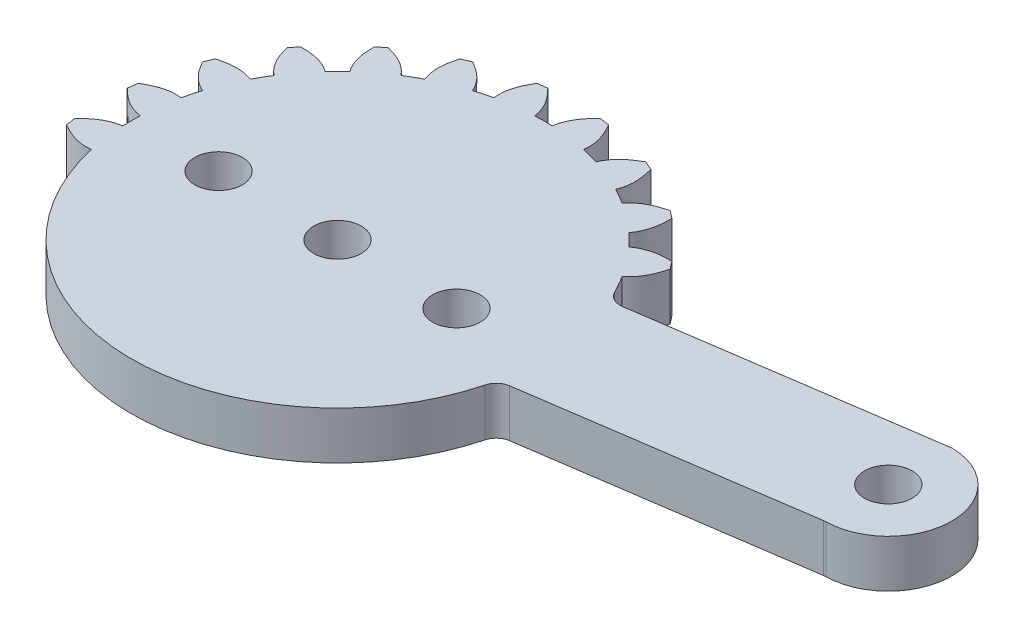
from build123d import *

# Parameters (mm, degrees)
SKETCH1_R           = 1.5
BOSS_EXTRUDE1_DEPTH = 3
L_EK1_SCALE         = 2


with BuildPart() as part:
    # Sketch1 → Boss-Extrude1 (new body)
    with BuildSketch(Plane(origin=(0, 0, 0), x_dir=(1, 0, 0), z_dir=(0, 1, 0))):
        with BuildLine():
            Line((12.632699085, 5.340493617), (30.652467528, 7.988606141))
            ThreePointArc((30.652467528, 7.988606141), (30.736256439, 7.997332941), (30.820482547, 7.998976483))
            ThreePointArc((30.820482547, 7.998976483), (34.729974115, 3.985609874), (30.791707503, 0.000476005))
            ThreePointArc((30.791707503, 0.000476005), (30.726552312, -0.002657016), (30.661739998, -0.010031215))
            Line((30.661739998, -0.010031215), (13.400696346, -2.546644602))
            ThreePointArc((13.400696346, -2.546644602), (12.878710947, -2.791300832), (12.578512819, -3.283445639))
            ThreePointArc((12.578512819, -3.283445639), (0.316986254, -12.996134799), (-12.403478945, -3.892776652))
            add(Edge.make_bspline(
                [(-12.403478945, -3.892776652), (-12.568432388, -3.367671042), (-12.688169827, -2.830255546)],
                knots=[0, 0, 0, 0.029411494, 0.029411494, 0.029411494], degree=2))
            add(Edge.make_bspline(
                [(-12.688169827, -2.830255546), (-13.526378309, -2.92825021), (-14.200348489, -2.631756771), (-14.828036033, -2.264806262)],
                knots=[0, 0, 0, 0, 0.585569533, 0.585569533, 0.585569533, 0.585569533], degree=3))
            add(Edge.make_bspline(
                [(-14.828036033, -2.264806262), (-14.874848849, -1.958311002), (-14.908957951, -1.650143267)],
                knots=[0, 0, 0, 1, 1, 1], degree=2))
            add(Edge.make_bspline(
                [(-12.988354961, -0.550123072), (-13.823365068, -0.672411814), (-14.397632122, -1.133238803), (-14.908957951, -1.650143267)],
                knots=[0, 0, 0, 0, 0.585569533, 0.585569533, 0.585569533, 0.585569533], degree=3))
            add(Edge.make_bspline(
                [(-12.988354961, -0.550123072), (-13.003945727, -0.183508375), (-13.00394681, 0.183466584), (-12.988354961, 0.550123072)],
                knots=[0.090903106, 0.090903106, 0.090903106, 0.090903106, 0.120321184, 0.120321184, 0.120321184, 0.120321184], degree=3))
            add(Edge.make_bspline(
                [(-12.988354961, 0.550123072), (-13.823365068, 0.672411814), (-14.397632122, 1.133238803), (-14.908957951, 1.650143267)],
                knots=[0, 0, 0, 0, 0.585569533, 0.585569533, 0.585569533, 0.585569533], degree=3))
            add(Edge.make_bspline(
                [(-14.908957951, 1.650143267), (-14.874848849, 1.958311002), (-14.828036033, 2.264806262)],
                knots=[0, 0, 0, 1, 1, 1], degree=2))
            add(Edge.make_bspline(
                [(-12.688169827, 2.830255546), (-13.526378309, 2.92825021), (-14.200348489, 2.631756771), (-14.828036033, 2.264806262)],
                knots=[0, 0, 0, 0, 0.585569533, 0.585569533, 0.585569533, 0.585569533], degree=3))
            add(Edge.make_bspline(
                [(-12.688169827, 2.830255546), (-12.60833596, 3.18844173), (-12.513361148, 3.542894104), (-12.40340517, 3.893011712)],
                knots=[0.181812796, 0.181812796, 0.181812796, 0.181812796, 0.211230873, 0.211230873, 0.211230873, 0.211230873], degree=3))
            add(Edge.make_bspline(
                [(-12.40340517, 3.893011712), (-13.178312342, 4.227250084), (-13.613740919, 4.821006025), (-13.973859024, 5.452638259)],
                knots=[0, 0, 0, 0, 0.585569533, 0.585569533, 0.585569533, 0.585569533], degree=3))
            add(Edge.make_bspline(
                [(-13.973859024, 5.452638259), (-13.861152482, 5.741477348), (-13.736607963, 6.025412987)],
                knots=[0, 0, 0, 1, 1, 1], degree=2))
            add(Edge.make_bspline(
                [(-11.523306886, 6.017756925), (-12.307591221, 6.329356822), (-13.035334574, 6.217402469), (-13.736607963, 6.025412987)],
                knots=[0, 0, 0, 0, 0.585569533, 0.585569533, 0.585569533, 0.585569533], degree=3))
            add(Edge.make_bspline(
                [(-11.523306886, 6.017756925), (-11.35348747, 6.343077502), (-11.170010092, 6.660869731), (-10.973183814, 6.970598036)],
                knots=[0.272722485, 0.272722485, 0.272722485, 0.272722485, 0.302140562, 0.302140562, 0.302140562, 0.302140562], degree=3))
            add(Edge.make_bspline(
                [(-10.973183814, 6.970598036), (-11.635179408, 7.494008246), (-11.902095771, 8.180229653), (-12.086464697, 8.883544965)],
                knots=[0, 0, 0, 0, 0.585569533, 0.585569533, 0.585569533, 0.585569533], degree=3))
            add(Edge.make_bspline(
                [(-12.086464697, 8.883544965), (-11.90284148, 9.133371501), (-11.709052762, 9.375397774)],
                knots=[0, 0, 0, 1, 1, 1], degree=2))
            add(Edge.make_bspline(
                [(-9.573149625, 8.795158115), (-10.250062131, 9.299128225), (-10.981984149, 9.379342464), (-11.709052762, 9.375397774)],
                knots=[0, 0, 0, 0, 0.585569533, 0.585569533, 0.585569533, 0.585569533], degree=3))
            add(Edge.make_bspline(
                [(-9.573149625, 8.795158115), (-9.324917477, 9.065441278), (-9.065441275, 9.324917485), (-8.795158115, 9.573149625)],
                knots=[0.363632174, 0.363632174, 0.363632174, 0.363632174, 0.393050251, 0.393050251, 0.393050251, 0.393050251], degree=3))
            add(Edge.make_bspline(
                [(-8.795158115, 9.573149625), (-9.299128225, 10.250062131), (-9.379342464, 10.981984149), (-9.375397774, 11.709052762)],
                knots=[0, 0, 0, 0, 0.585569533, 0.585569533, 0.585569533, 0.585569533], degree=3))
            add(Edge.make_bspline(
                [(-9.375397774, 11.709052762), (-9.133371501, 11.90284148), (-8.883544965, 12.086464697)],
                knots=[0, 0, 0, 1, 1, 1], degree=2))
            add(Edge.make_bspline(
                [(-6.970598036, 10.973183814), (-7.494008246, 11.635179408), (-8.180229653, 11.902095771), (-8.883544965, 12.086464697)],
                knots=[0, 0, 0, 0, 0.585569533, 0.585569533, 0.585569533, 0.585569533], degree=3))
            add(Edge.make_bspline(
                [(-6.970598036, 10.973183814), (-6.660869762, 11.170010102), (-6.343077615, 11.353487483), (-6.017756925, 11.523306886)],
                knots=[0.454541863, 0.454541863, 0.454541863, 0.454541863, 0.48395994, 0.48395994, 0.48395994, 0.48395994], degree=3))
            add(Edge.make_bspline(
                [(-6.017756925, 11.523306886), (-6.329356822, 12.307591221), (-6.217402469, 13.035334574), (-6.025412987, 13.736607963)],
                knots=[0, 0, 0, 0, 0.585569533, 0.585569533, 0.585569533, 0.585569533], degree=3))
            add(Edge.make_bspline(
                [(-6.025412987, 13.736607963), (-5.741477348, 13.861152482), (-5.452638259, 13.973859024)],
                knots=[0, 0, 0, 1, 1, 1], degree=2))
            add(Edge.make_bspline(
                [(-3.893011712, 12.40340517), (-4.227250084, 13.178312342), (-4.821006025, 13.613740919), (-5.452638259, 13.973859024)],
                knots=[0, 0, 0, 0, 0.585569533, 0.585569533, 0.585569533, 0.585569533], degree=3))
            add(Edge.make_bspline(
                [(-3.893011712, 12.40340517), (-3.54289478, 12.513361188), (-3.188443695, 12.608336067), (-2.830255546, 12.688169827)],
                knots=[0.545451553, 0.545451553, 0.545451553, 0.545451553, 0.57486963, 0.57486963, 0.57486963, 0.57486963], degree=3))
            add(Edge.make_bspline(
                [(-2.830255546, 12.688169827), (-2.92825021, 13.526378309), (-2.631756771, 14.200348489), (-2.264806262, 14.828036033)],
                knots=[0, 0, 0, 0, 0.585569533, 0.585569533, 0.585569533, 0.585569533], degree=3))
            add(Edge.make_bspline(
                [(-2.264806262, 14.828036033), (-1.958311002, 14.874848849), (-1.650143267, 14.908957951)],
                knots=[0, 0, 0, 1, 1, 1], degree=2))
            add(Edge.make_bspline(
                [(-0.550123072, 12.988354961), (-0.672411814, 13.823365068), (-1.133238803, 14.397632122), (-1.650143267, 14.908957951)],
                knots=[0, 0, 0, 0, 0.585569533, 0.585569533, 0.585569533, 0.585569533], degree=3))
            add(Edge.make_bspline(
                [(-0.550123072, 12.988354961), (-0.183477364, 13.003947374), (0.183477419, 13.003947344), (0.550123072, 12.988354961)],
                knots=[0.636361242, 0.636361242, 0.636361242, 0.636361242, 0.665779319, 0.665779319, 0.665779319, 0.665779319], degree=3))
            add(Edge.make_bspline(
                [(0.550123072, 12.988354961), (0.672411814, 13.823365068), (1.133238803, 14.397632122), (1.650143267, 14.908957951)],
                knots=[0, 0, 0, 0, 0.585569533, 0.585569533, 0.585569533, 0.585569533], degree=3))
            add(Edge.make_bspline(
                [(1.650143267, 14.908957951), (1.958311002, 14.874848849), (2.264806262, 14.828036033)],
                knots=[0, 0, 0, 1, 1, 1], degree=2))
            add(Edge.make_bspline(
                [(2.830255546, 12.688169827), (2.92825021, 13.526378309), (2.631756771, 14.200348489), (2.264806262, 14.828036033)],
                knots=[0, 0, 0, 0, 0.585569533, 0.585569533, 0.585569533, 0.585569533], degree=3))
            add(Edge.make_bspline(
                [(2.830255546, 12.688169827), (3.188443874, 12.608335818), (3.542895259, 12.513360471), (3.893011712, 12.40340517)],
                knots=[0.727270931, 0.727270931, 0.727270931, 0.727270931, 0.756689008, 0.756689008, 0.756689008, 0.756689008], degree=3))
            add(Edge.make_bspline(
                [(3.893011712, 12.40340517), (4.227250084, 13.178312342), (4.821006025, 13.613740919), (5.452638259, 13.973859024)],
                knots=[0, 0, 0, 0, 0.585569533, 0.585569533, 0.585569533, 0.585569533], degree=3))
            add(Edge.make_bspline(
                [(5.452638259, 13.973859024), (5.741477348, 13.861152482), (6.025412987, 13.736607963)],
                knots=[0, 0, 0, 1, 1, 1], degree=2))
            add(Edge.make_bspline(
                [(6.017756925, 11.523306886), (6.329356822, 12.307591221), (6.217402469, 13.035334574), (6.025412987, 13.736607963)],
                knots=[0, 0, 0, 0, 0.585569533, 0.585569533, 0.585569533, 0.585569533], degree=3))
            add(Edge.make_bspline(
                [(6.017756925, 11.523306886), (6.343080162, 11.353483585), (6.660877044, 11.16999893), (6.970598036, 10.973183814)],
                knots=[0.81818062, 0.81818062, 0.81818062, 0.81818062, 0.847598697, 0.847598697, 0.847598697, 0.847598697], degree=3))
            add(Edge.make_bspline(
                [(6.970598036, 10.973183814), (7.494008246, 11.635179408), (8.180229653, 11.902095771), (8.883544965, 12.086464697)],
                knots=[0, 0, 0, 0, 0.585569533, 0.585569533, 0.585569533, 0.585569533], degree=3))
            add(Edge.make_bspline(
                [(8.883544965, 12.086464697), (9.133371501, 11.90284148), (9.375397774, 11.709052762)],
                knots=[0, 0, 0, 1, 1, 1], degree=2))
            add(Edge.make_bspline(
                [(8.795158115, 9.573149625), (9.299128225, 10.250062131), (9.379342464, 10.981984149), (9.375397774, 11.709052762)],
                knots=[0, 0, 0, 0, 0.585569533, 0.585569533, 0.585569533, 0.585569533], degree=3))
            add(Edge.make_bspline(
                [(8.795158115, 9.573149625), (9.065480928, 9.3248566), (9.325031193, 9.065266643), (9.573149625, 8.795158115)],
                knots=[0.909090309, 0.909090309, 0.909090309, 0.909090309, 0.938508386, 0.938508386, 0.938508386, 0.938508386], degree=3))
            add(Edge.make_bspline(
                [(9.573149625, 8.795158115), (10.250062131, 9.299128225), (10.981984149, 9.379342464), (11.709052762, 9.375397774)],
                knots=[0, 0, 0, 0, 0.585569533, 0.585569533, 0.585569533, 0.585569533], degree=3))
            add(Edge.make_bspline(
                [(11.709052762, 9.375397774), (11.90284148, 9.133371501), (12.086464697, 8.883544965)],
                knots=[0, 0, 0, 1, 1, 1], degree=2))
            add(Edge.make_bspline(
                [(10.973183814, 6.970598036), (11.635179408, 7.494008246), (11.902095771, 8.180229653), (12.086464697, 8.883544965)],
                knots=[0, 0, 0, 0, 0.585569533, 0.585569533, 0.585569533, 0.585569533], degree=3))
            ThreePointArc((10.973183814, 6.970598036), (11.297491618, 6.431693645), (11.595354368, 5.87773401))
            ThreePointArc((11.595354368, 5.87773401), (12.027420742, 5.441888374), (12.632699085, 5.340493617))
        make_face()
        with Locations(Location((0, 0, 0), (0, 0, 270))):
            Circle(SKETCH1_R, mode=Mode.SUBTRACT)
        with Locations(Location((7.5, 0, 0), (0, 0, 270))):
            Circle(SKETCH1_R, mode=Mode.SUBTRACT)
        with Locations(Location((-7.5, 0, 0), (0, 0, 270))):
            Circle(SKETCH1_R, mode=Mode.SUBTRACT)
        with Locations(Location((30.73, 4, 0), (0, 0, 270))):
            Circle(SKETCH1_R, mode=Mode.SUBTRACT)
    extrude(amount=BOSS_EXTRUDE1_DEPTH)


with BuildPart() as part_1:
    # Ölçek1: scaled about (5.054854576, 1.5, -1.125448484)
    add(part.part.scale(L_EK1_SCALE).moved(Location((-5.054854576, -1.5, 1.125448484))))


solid = part_1.part
